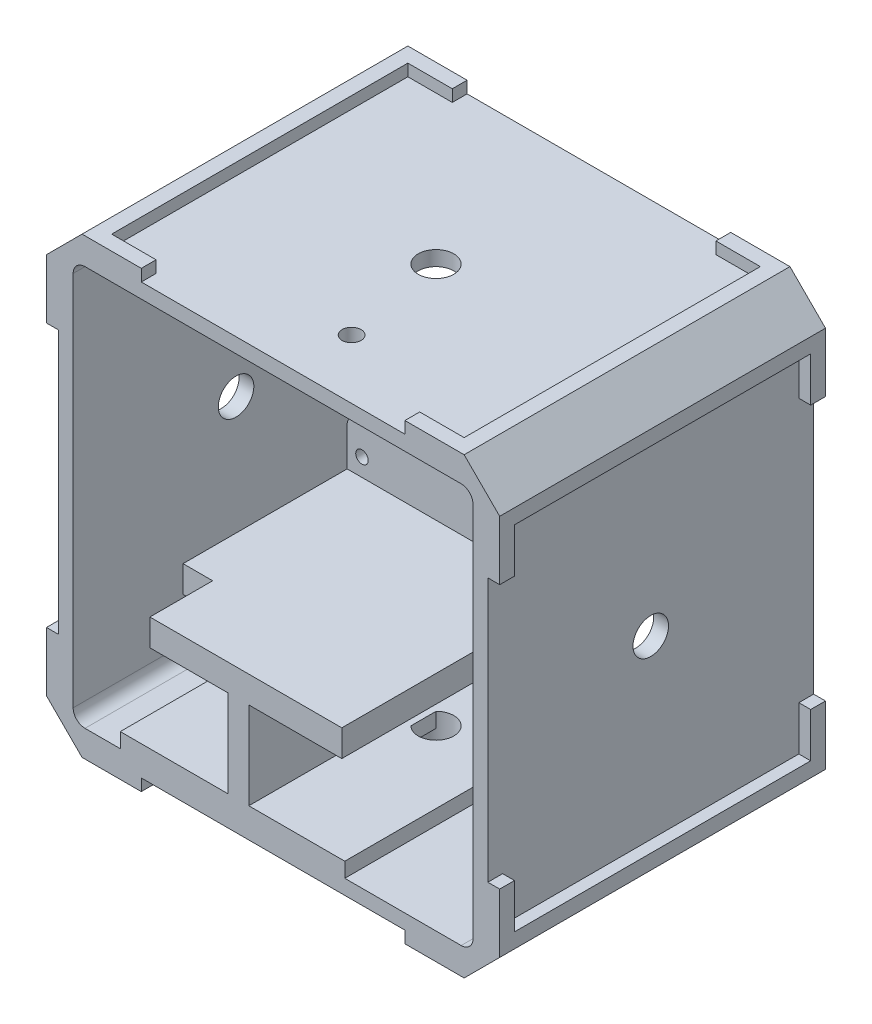
from build123d import *
from build123d.topology import SkipClean

# Parameters (mm, degrees)
BOSS_EXTRUDE1_DEPTH            = 55
SKETCH2_W                      = 67.5
SKETCH2_H                      = 67.5
BOSS_EXTRUDE2_DEPTH            = 2.5
CUT_EXTRUDE2_REACH             = 77.187
SKETCH4_R                      = 1.65
MIRROR2_COPY_1_REACH           = 77.187
MIRROR2_COPY_1_SKETCH_R        = 1.65
BOSS_EXTRUDE3_DEPTH            = 14.6
BOSS_EXTRUDE3_DEPTH_BACK       = 25.8
BOSS_EXTRUDE4_DEPTH            = 47
SKETCH7_W                      = 37.9
SKETCH7_H                      = 19.5
CUT_EXTRUDE3_DEPTH             = 9.4
BOSS_EXTRUDE7_DEPTH            = 2
CUT_EXTRUDE6_REACH             = 85.213
CUT_EXTRUDE6_DIRECTION_2_DEPTH = 84.213490493
CUT_EXTRUDE8_DEPTH             = 104.526192338
CUT_EXTRUDE8_DEPTH_BACK        = 2.5
SKETCH15_R                     = 1.6
SKETCH16_W                     = 7.5
SKETCH16_H                     = 1.65
BOSS_EXTRUDE8_DEPTH            = 7
CUT_EXTRUDE9_REACH             = 74.438
SKETCH17_R                     = 1.05
SKETCH19_R                     = 3
CUT_EXTRUDE10_DEPTH            = 2.5
BOSS_EXTRUDE9_DEPTH            = 2
CIRPATTERN1_COUNT              = 4
CIRPATTERN2_COUNT              = 4
CUT_EXTRUDE11_DEPTH            = 2.5
BOSS_EXTRUDE12_DEPTH           = 55
CUT_EXTRUDE12_REACH            = 75.459
SKETCH23_W                     = 6.5
SKETCH23_H                     = 16
BOSS_EXTRUDE13_REACH           = 93.671
FILLET2_R                      = 1.5
CHAMFER1_SIZE                  = 0.75
CUT_EXTRUDE13_REACH            = 92.197
SKETCH25_W                     = 3
SKETCH25_H                     = 35
SKETCH25_W_2                   = 5
SKETCH25_H_2                   = 20
FILLET3_R                      = 1.5
SKETCH26_W                     = 12.543976605
SKETCH26_H                     = 9.586128164
CUT_EXTRUDE14_DEPTH            = 90.974690886


with BuildPart() as part:
    # Sketch1 → Boss-Extrude1 (new body)
    with BuildSketch(Plane.XY):
        with BuildLine():
            Line((-36.25, 32.25), (-36.25, -32.25))
            ThreePointArc((-36.25, -32.25), (-35.078427125, -35.078427125), (-32.25, -36.25))
            Line((-32.25, -36.25), (32.25, -36.25))
            ThreePointArc((32.25, -36.25), (35.078427125, -35.078427125), (36.25, -32.25))
            Line((36.25, -32.25), (36.25, 32.25))
            ThreePointArc((36.25, 32.25), (35.078427125, 35.078427125), (32.25, 36.25))
            Line((32.25, 36.25), (-32.25, 36.25))
            ThreePointArc((-32.25, 36.25), (-35.078427125, 35.078427125), (-36.25, 32.25))
        make_face()
        with BuildLine():
            Line((-31.75, 33.75), (31.75, 33.75))
            ThreePointArc((31.75, 33.75), (33.164213562, 33.164213562), (33.75, 31.75))
            Line((33.75, 31.75), (33.75, -31.75))
            ThreePointArc((33.75, -31.75), (33.164213562, -33.164213562), (31.75, -33.75))
            Line((31.75, -33.75), (-31.75, -33.75))
            ThreePointArc((-31.75, -33.75), (-33.164213562, -33.164213562), (-33.75, -31.75))
            Line((-33.75, -31.75), (-33.75, 31.75))
            ThreePointArc((-33.75, 31.75), (-33.164213562, 33.164213562), (-31.75, 33.75))
        make_face(mode=Mode.SUBTRACT)
    extrude(amount=BOSS_EXTRUDE1_DEPTH)

    # Sketch2 → Boss-Extrude2 (add)
    with BuildSketch(Plane.XY):
        Rectangle(SKETCH2_W, SKETCH2_H)
    extrude(amount=BOSS_EXTRUDE2_DEPTH)

    # Sketch4 → Cut-Extrude2 (cut, up to next)
    with BuildSketch(Plane(origin=(0, 0, 0), x_dir=(-1, 0, 0), z_dir=(0, 0, -1)), mode=Mode.PRIVATE) as cut_extrude2_sk1:
        with Locations((-28.75, 28.75)):
            Circle(SKETCH4_R)
    cut_extrude2_tool1 = extrude(cut_extrude2_sk1.sketch, amount=-CUT_EXTRUDE2_REACH, mode=Mode.PRIVATE) & part.part
    cut_extrude2 = cut_extrude2_tool1.solids().sort_by_distance((28.75, 28.75, 0))[0]
    add(cut_extrude2, mode=Mode.SUBTRACT)

    # Mirror1: Cut-Extrude2 across plane
    add(cut_extrude2.mirror(Plane(origin=(0, 0, 0), x_dir=(0, 0, 1), z_dir=(1, 0, 0))), mode=Mode.SUBTRACT)

    # Mirror2: Cut-Extrude2 across plane
    add(cut_extrude2.mirror(Plane.ZX), mode=Mode.SUBTRACT)

    # Mirror2 copy 1 sketch → Mirror2 copy 1 (cut, up to next)
    with BuildSketch(Plane(origin=(0, 0, 0), x_dir=(1, 0, 0), z_dir=(0, 0, -1)), mode=Mode.PRIVATE) as mirror2_copy_1_sk1:
        with Locations((-28.75, 28.75)):
            Circle(MIRROR2_COPY_1_SKETCH_R)
    mirror2_copy_1_tool1 = extrude(mirror2_copy_1_sk1.sketch, amount=-MIRROR2_COPY_1_REACH, mode=Mode.PRIVATE) & part.part
    add(mirror2_copy_1_tool1.solids().sort_by_distance((-28.75, -28.75, 0))[0], mode=Mode.SUBTRACT)



with BuildPart() as body_2:
    # Sketch5 → Boss-Extrude3 (new, two sides: drawn at the far end of the back side and taken through both)
    with BuildSketch(Plane(origin=(0, 0, 0), x_dir=(0, 0, -1), z_dir=(1, 0, 0)).offset(-BOSS_EXTRUDE3_DEPTH_BACK)):
        Polygon((-16.7, 12), (-16.7, -12), (-62.4, -12), (-64.4, -12), (-64.4, -14), (-14.7, -14), (-14.7, 12), align=None)
    extrude(amount=BOSS_EXTRUDE3_DEPTH + BOSS_EXTRUDE3_DEPTH_BACK)


with BuildPart() as part_1:
    add(part.part)

    add(body_2.part)  # Boss-Extrude4 merges body 2
    # Sketch6 → Boss-Extrude4 (add)
    with BuildSketch(Plane.XY.offset(64.4)):
        Polygon((-25.8, -14), (12.1, -14), (12.1, -16.5), (-4.1, -16.5), (-4.1, -31.25), (12.1, -31.25), (12.1, -33.75), (-25.8, -33.75), (-25.8, -31.25), (-7.6, -31.25), (-7.6, -16.5), (-25.8, -16.5), align=None)
    extrude(amount=-BOSS_EXTRUDE4_DEPTH)

    # Sketch7 → Cut-Extrude3 (cut)
    with BuildSketch(Plane.XY.offset(64.4)):
        with Locations((-6.85, -24)):
            Rectangle(SKETCH7_W, SKETCH7_H)
    extrude(amount=-CUT_EXTRUDE3_DEPTH, mode=Mode.SUBTRACT)

    # Sketch12 → Boss-Extrude7 (add)
    with BuildSketch(Plane(origin=(0, 36.25, 0), x_dir=(1, 0, 0), z_dir=(0, 1, 0))):
        Polygon((29.75, -55), (32.25, -55), (32.25, -52.5), (32.25, -45), (29.75, -45), (29.75, -52.5), (22.25, -52.5), (22.25, -55), align=None)
        Polygon((-32.25, 0), (-32.25, -10), (-29.75, -10), (-29.75, -2.5), (-22.25, -2.5), (-22.25, 0), align=None)
    boss_extrude7 = extrude(amount=BOSS_EXTRUDE7_DEPTH)

    # Sketch13 → Cut-Extrude6 (cut, up to next)
    with BuildSketch(Plane(origin=(0, 0, 0), x_dir=(-1, 0, 0), z_dir=(0, 0, -1)), mode=Mode.PRIVATE) as cut_extrude6_sk1:
        with BuildLine():
            Line((-33.75, 21.25), (-25.25, 21.25))
            ThreePointArc((-25.25, 21.25), (-22.421572875, 22.421572875), (-21.25, 25.25))
            Line((-21.25, 25.25), (-21.25, 33.75))
            Line((-21.25, 33.75), (21.25, 33.75))
            Line((21.25, 33.75), (21.25, 25.25))
            ThreePointArc((21.25, 25.25), (22.421572875, 22.421572875), (25.25, 21.25))
            Line((25.25, 21.25), (33.75, 21.25))
            Line((33.75, 21.25), (33.75, -21.25))
            Line((33.75, -21.25), (25.25, -21.25))
            ThreePointArc((25.25, -21.25), (22.421572875, -22.421572875), (21.25, -25.25))
            Line((21.25, -25.25), (21.25, -33.75))
            Line((21.25, -33.75), (-21.25, -33.75))
            Line((-21.25, -33.75), (-21.25, -25.25))
            ThreePointArc((-21.25, -25.25), (-22.421572875, -22.421572875), (-25.25, -21.25))
            Line((-25.25, -21.25), (-33.75, -21.25))
            Line((-33.75, -21.25), (-33.75, 21.25))
        make_face()
    cut_extrude6_tool1 = extrude(cut_extrude6_sk1.sketch, amount=-CUT_EXTRUDE6_REACH, mode=Mode.PRIVATE) & part_1.part
    add(cut_extrude6_tool1.solids().sort_by_distance((0, 0, 0))[0], mode=Mode.SUBTRACT)

    # Sketch13 → Cut-Extrude6 direction 2 (cut)
    with BuildSketch(Plane(origin=(0, 0, 0), x_dir=(-1, 0, 0), z_dir=(0, 0, -1))):
        with BuildLine():
            Line((-33.75, 21.25), (-25.25, 21.25))
            ThreePointArc((-25.25, 21.25), (-22.421572875, 22.421572875), (-21.25, 25.25))
            Line((-21.25, 25.25), (-21.25, 33.75))
            Line((-21.25, 33.75), (21.25, 33.75))
            Line((21.25, 33.75), (21.25, 25.25))
            ThreePointArc((21.25, 25.25), (22.421572875, 22.421572875), (25.25, 21.25))
            Line((25.25, 21.25), (33.75, 21.25))
            Line((33.75, 21.25), (33.75, -21.25))
            Line((33.75, -21.25), (25.25, -21.25))
            ThreePointArc((25.25, -21.25), (22.421572875, -22.421572875), (21.25, -25.25))
            Line((21.25, -25.25), (21.25, -33.75))
            Line((21.25, -33.75), (-21.25, -33.75))
            Line((-21.25, -33.75), (-21.25, -25.25))
            ThreePointArc((-21.25, -25.25), (-22.421572875, -22.421572875), (-25.25, -21.25))
            Line((-25.25, -21.25), (-33.75, -21.25))
            Line((-33.75, -21.25), (-33.75, 21.25))
        make_face()
    extrude(amount=CUT_EXTRUDE6_DIRECTION_2_DEPTH, mode=Mode.SUBTRACT)

    # Sketch15 → Cut-Extrude8 (cut, two sides: drawn at the far end of the back side and taken through both)
    with BuildSketch(Plane(origin=(0, 36.25, 0), x_dir=(1, 0, 0), z_dir=(0, 1, 0)).offset(-CUT_EXTRUDE8_DEPTH_BACK)):
        with Locations(Location((3.25, -45, 0), (0, 0, 90))):
            Circle(SKETCH15_R)
    extrude(amount=CUT_EXTRUDE8_DEPTH + CUT_EXTRUDE8_DEPTH_BACK, mode=Mode.SUBTRACT)

    # Sketch16 → Boss-Extrude8 (add)
    with BuildSketch(Plane(origin=(-33.75, 0, 0), x_dir=(0, 0, -1), z_dir=(1, 0, 0))):
        with Locations((-12.25, 29.525)):
            Rectangle(SKETCH16_W, SKETCH16_H)
    extrude(amount=BOSS_EXTRUDE8_DEPTH)

    # Sketch17 → Cut-Extrude9 (cut, up to next)
    with BuildSketch(Plane(origin=(0, 0, 14.7), x_dir=(-1, 0, 0), z_dir=(0, 0, -1)), mode=Mode.PRIVATE) as cut_extrude9_sk1:
        with Locations(Location((-12.1, 9, 0), (0, 0, 90))):
            Circle(SKETCH17_R)
    cut_extrude9_tool1 = extrude(cut_extrude9_sk1.sketch, amount=-CUT_EXTRUDE9_REACH, mode=Mode.PRIVATE) & part_1.part
    # Sketch17 → Cut-Extrude9 (cut, up to next)
    with BuildSketch(Plane(origin=(0, 0, 14.7), x_dir=(-1, 0, 0), z_dir=(0, 0, -1)), mode=Mode.PRIVATE) as cut_extrude9_sk2:
        with Locations(Location((-12.1, -9, 0), (0, 0, 90))):
            Circle(SKETCH17_R)
    cut_extrude9_tool2 = extrude(cut_extrude9_sk2.sketch, amount=-CUT_EXTRUDE9_REACH, mode=Mode.PRIVATE) & part_1.part
    # Sketch17 → Cut-Extrude9 (cut, up to next)
    with BuildSketch(Plane(origin=(0, 0, 14.7), x_dir=(-1, 0, 0), z_dir=(0, 0, -1)), mode=Mode.PRIVATE) as cut_extrude9_sk3:
        with Locations(Location((23.3, -9, 0), (0, 0, 90))):
            Circle(SKETCH17_R)
    cut_extrude9_tool3 = extrude(cut_extrude9_sk3.sketch, amount=-CUT_EXTRUDE9_REACH, mode=Mode.PRIVATE) & part_1.part
    add(cut_extrude9_tool1.solids().sort_by_distance((12.1, 9, 14.7))[0], mode=Mode.SUBTRACT)
    add(cut_extrude9_tool2.solids().sort_by_distance((12.1, -9, 14.7))[0], mode=Mode.SUBTRACT)
    add(cut_extrude9_tool3.solids().sort_by_distance((-23.3, -9, 14.7))[0], mode=Mode.SUBTRACT)

    # Sketch19 → Cut-Extrude10 (cut)
    with BuildSketch(Plane(origin=(0, 36.25, 0), x_dir=(1, 0, 0), z_dir=(0, 1, 0))):
        with Locations(Location((0, -27.5, 0), (0, 0, 270))):
            Circle(SKETCH19_R)
    cut_extrude10 = extrude(amount=-CUT_EXTRUDE10_DEPTH, mode=Mode.SUBTRACT)

    # Sketch20 → Boss-Extrude9 (add)
    with BuildSketch(Plane(origin=(36.25, 0, -36.25), x_dir=(0, 0, 1), z_dir=(-1, 0, 0))):
        Polygon((91.25, 32.25), (81.25, 32.25), (81.25, 29.75), (88.75, 29.75), (88.75, 22.25), (91.25, 22.25), align=None)
        Polygon((36.25, -22.25), (36.25, -32.25), (46.25, -32.25), (46.25, -29.75), (38.75, -29.75), (38.75, -22.25), align=None)
    boss_extrude9 = extrude(amount=-BOSS_EXTRUDE9_DEPTH)

    # CirPattern1: Boss-Extrude7, Cut-Extrude10 ×4 about axis
    cirpattern1_axis = Axis((0, 0, 0), (0, 0, 1))
    add([boss_extrude7.rotate(cirpattern1_axis, i * 360 / CIRPATTERN1_COUNT) for i in range(1, CIRPATTERN1_COUNT)])
    add([cut_extrude10.rotate(cirpattern1_axis, i * 360 / CIRPATTERN1_COUNT) for i in range(1, CIRPATTERN1_COUNT)], mode=Mode.SUBTRACT)

    # CirPattern2: Boss-Extrude9 ×4 about axis
    cirpattern2_axis = Axis((0, 0, 0), (0, 0, 1))
    for i in range(1, CIRPATTERN2_COUNT):
        add(boss_extrude9.rotate(cirpattern2_axis, i * 360 / CIRPATTERN2_COUNT))

    # Sketch21 → Cut-Extrude11 (cut)
    with BuildSketch(Plane.XZ.offset(33.75)):
        with BuildLine():
            Line((-2.11, 25.367419404), (-2.11, 29.632580596))
            ThreePointArc((-2.11, 29.632580596), (3, 27.5), (-2.11, 25.367419404))
        make_face()
    extrude(amount=-CUT_EXTRUDE11_DEPTH, mode=Mode.SUBTRACT)

    # Sketch22 → Boss-Extrude12 (add, through all)
    with BuildSketch(Plane.XY.offset(55)):
        Polygon((-38.25, 32.25), (-32.25, 38.25), (-29.75, 38.25), (-29.75, 33.75), (-33.75, 33.75), (-33.75, 29.75), (-38.25, 29.75), align=None)
        Polygon((33.75, 33.75), (33.75, 29.75), (38.25, 29.75), (38.25, 32.25), (32.25, 38.25), (29.75, 38.25), (29.75, 33.75), align=None)
        Polygon((38.25, -32.25), (32.25, -38.25), (29.75, -38.25), (29.75, -33.75), (33.75, -33.75), (33.75, -29.75), (38.25, -29.75), align=None)
        Polygon((-33.75, -33.75), (-33.75, -29.75), (-38.25, -29.75), (-38.25, -32.25), (-32.25, -38.25), (-29.75, -38.25), (-29.75, -33.75), align=None)
    extrude(amount=-BOSS_EXTRUDE12_DEPTH)

    # Sketch23 → Cut-Extrude12 (cut, up to next)
    with BuildSketch(Plane(origin=(0, 0, 14.7), x_dir=(-1, 0, 0), z_dir=(0, 0, -1)), mode=Mode.PRIVATE) as cut_extrude12_sk1:
        with Locations((22.55, 4)):
            Rectangle(SKETCH23_W, SKETCH23_H)
    cut_extrude12_tool1 = extrude(cut_extrude12_sk1.sketch, amount=-CUT_EXTRUDE12_REACH, mode=Mode.PRIVATE) & part_1.part
    add(cut_extrude12_tool1.solids().sort_by_distance((-22.55, 4, 14.7))[0], mode=Mode.SUBTRACT)

    # Boss-Extrude13: up to this face of the body (flat: up to its plane)
    boss_extrude13_end = Plane(part_1.part.faces().sort_by_distance((-25.8, -13.63350059, 36.484368359))[0])
    # Sketch24 → Boss-Extrude13 (add, up to the picked face)
    with BuildSketch(Plane(origin=(14.6, 0, 0), x_dir=(0, 0, -1), z_dir=(1, 0, 0)), mode=Mode.PRIVATE) as boss_extrude13_sk1:
        with BuildLine():
            Line((-17.4, -16.5), (-17.4, -13.792))
            Line((-17.4, -13.792), (-14.7, -14))
            ThreePointArc((-14.7, -14), (-15.560163051, -15.779023905), (-17.4, -16.5))
        make_face()
    boss_extrude13_tool1 = split(extrude(boss_extrude13_sk1.sketch, amount=-BOSS_EXTRUDE13_REACH, mode=Mode.PRIVATE), bisect_by=boss_extrude13_end, keep=Keep.BOTH, mode=Mode.PRIVATE)
    add(boss_extrude13_tool1.solids().sort_by(Axis((14.6, -14.996891, 16.28436), (-1, 0, 0)))[0])

    # Fillet2
    fillet2_edges = [part_1.edges().sort_by_distance(p)[0] for p in [
        (14.6, 12, 15.7),
    ]]
    fillet(fillet2_edges, radius=FILLET2_R)

    # Chamfer1
    chamfer1_edges = [part_1.edges().sort_by_distance(p)[0] for p in [
        (-33.75, 28.7, 12.25),
        (-30.25, 30.35, 16),
        (-26.75, 30.35, 12.25),
    ]]
    chamfer(chamfer1_edges, length=CHAMFER1_SIZE)

    # Sketch25 → Cut-Extrude13 (cut, up to next)
    with BuildSketch(Plane(origin=(0, -12, 0), x_dir=(1, 0, 0), z_dir=(0, 1, 0)), mode=Mode.PRIVATE) as cut_extrude13_sk1:
        with Locations((13.1, -46.9)):
            Rectangle(SKETCH25_W, SKETCH25_H)
    cut_extrude13_tool1 = extrude(cut_extrude13_sk1.sketch, amount=-CUT_EXTRUDE13_REACH, mode=Mode.PRIVATE) & part_1.part
    # Sketch25 → Cut-Extrude13 (cut, up to next)
    with BuildSketch(Plane(origin=(0, -12, 0), x_dir=(1, 0, 0), z_dir=(0, 1, 0)), mode=Mode.PRIVATE) as cut_extrude13_sk2:
        with Locations((-23.3, -54.4)):
            Rectangle(SKETCH25_W_2, SKETCH25_H_2)
    cut_extrude13_tool2 = extrude(cut_extrude13_sk2.sketch, amount=-CUT_EXTRUDE13_REACH, mode=Mode.PRIVATE) & part_1.part
    add(cut_extrude13_tool1.solids().sort_by_distance((13.1, -12, 46.9))[0], mode=Mode.SUBTRACT)
    add(cut_extrude13_tool2.solids().sort_by_distance((-23.3, -12, 54.4))[0], mode=Mode.SUBTRACT)

    # Fillet3
    fillet3_edges = [part_1.edges().sort_by_distance(p)[0] for p in [
        (-19.3, -4, 15.7),
        (-19.3, 12, 15.7),
        (-25.8, -4, 15.7),
    ]]
    fillet(fillet3_edges, radius=FILLET3_R)

    # Sketch26 → Cut-Extrude14 (cut, through all)
    with SkipClean():  # the faces are left unmerged after this step: merging them gives an invalid solid
        with BuildSketch(Plane(origin=(11.6, 0, 0), x_dir=(0, 0, -1), z_dir=(1, 0, 0))):
            with Locations((-61.271988302, -13.249120227)):
                Rectangle(SKETCH26_W, SKETCH26_H)
        extrude(amount=-CUT_EXTRUDE14_DEPTH, mode=Mode.SUBTRACT)


solid = part_1.part
